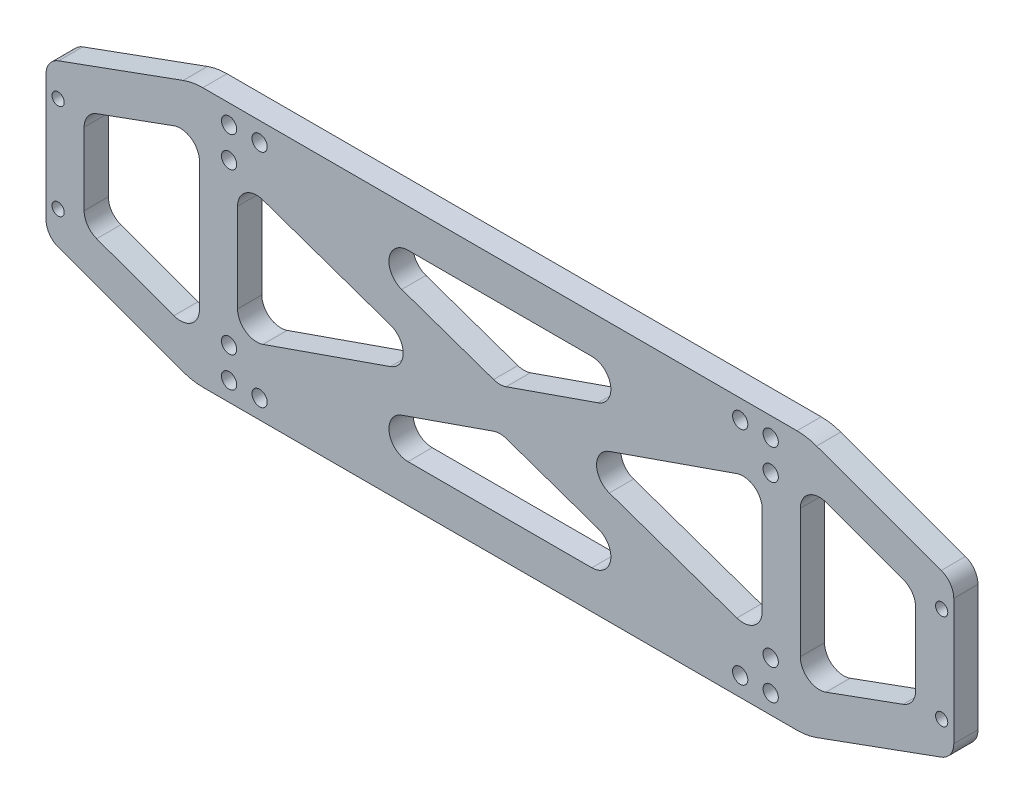
from build123d import *

# Parameters (mm, degrees)
BOSS_EXTRUDE1_DEPTH      = 6.35
M3_CLEARANCE_HOLE1_D     = 3.2
M3_CLEARANCE_HOLE1_DEPTH = 95.7
M3_CLEARANCE_HOLE1_TIP   = 0.96137699
FILLET1_R                = 5
FILLET2_R                = 15
CUT_EXTRUDE1_DEPTH       = 124.924664615
SKETCH6_W                = 10
SKETCH6_H                = 48
BOSS_EXTRUDE2_DEPTH      = 6.35
EXTRUDE_THIN1_DEPTH      = 6.35
F_4_0_REAMED_D           = 4
MIRROR3_COPY_1_D         = 4
FILLET3_R                = 5


with BuildPart() as part:
    # Sketch1 → Boss-Extrude1 (new body)
    with BuildSketch(Plane.XY):
        Polygon((80.535316128, 34), (119, 20), (119, -20), (80.535316128, -34), (-80.535316128, -34), (-119, -20), (-119, 20), (-80.535316128, 34), align=None)
    extrude(amount=BOSS_EXTRUDE1_DEPTH)

    # M3 Clearance Hole1
    with Locations(Plane(origin=(0, 0, 0), x_dir=(1, 0, 0), z_dir=(0, 0, -1))):
        with Locations((115.825, -12.5), (115.825, 12.5), (-115.825, 12.5), (-115.825, -12.5)):
            Hole(M3_CLEARANCE_HOLE1_D / 2, depth=M3_CLEARANCE_HOLE1_DEPTH)
            with Locations((0, 0, -(M3_CLEARANCE_HOLE1_DEPTH + M3_CLEARANCE_HOLE1_TIP / 2))):  # 118° drill point
                Cone(0, M3_CLEARANCE_HOLE1_D / 2, M3_CLEARANCE_HOLE1_TIP, mode=Mode.SUBTRACT)

    # Fillet1
    fillet1_edges = [part.edges().sort_by_distance(p)[0] for p in [
        (119, -20, 3.175),
        (-119, -20, 3.175),
        (-119, 20, 3.175),
        (119, 20, 3.175),
    ]]
    fillet(fillet1_edges, radius=FILLET1_R)

    # Fillet2
    fillet2_edges = [part.edges().sort_by_distance(p)[0] for p in [
        (80.535316128, -34, 3.175),
        (-80.535316128, -34, 3.175),
        (-80.535316128, 34, 3.175),
        (80.535316128, 34, 3.175),
    ]]
    fillet(fillet2_edges, radius=FILLET2_R)

    # Sketch5 → Cut-Extrude1 (cut, through all)
    with BuildSketch(Plane(origin=(0, 0, 0), x_dir=(-1, 0, 0), z_dir=(0, 0, -1))):
        Polygon((-78.772046321, 24), (-109, 12.997924618), (-109, -12.997924618), (-78.772046321, -24), (78.772046321, -24), (109, -12.997924618), (109, 12.997924618), (78.772046321, 24), align=None)
    extrude(amount=-CUT_EXTRUDE1_DEPTH, mode=Mode.SUBTRACT)

    # Sketch6 → Boss-Extrude2 (add)
    with BuildSketch(Plane(origin=(0, 0, 0), x_dir=(-1, 0, 0), z_dir=(0, 0, -1))):
        with Locations((-73.772046321, 0)):
            Rectangle(SKETCH6_W, SKETCH6_H)
        with Locations((73.772046321, 0)):
            Rectangle(SKETCH6_W, SKETCH6_H)
    extrude(amount=-BOSS_EXTRUDE2_DEPTH)

    # Sketch7 → Extrude-Thin1 (add)
    with BuildSketch(Plane(origin=(0, 0, 0), x_dir=(-1, 0, 0), z_dir=(0, 0, -1))):
        Polygon((67.124588801, 28.720792701), (-70.41950384, -19.279207299), (-67.124588801, -28.720792701), (70.41950384, 19.279207299), align=None)
    extrude_thin1 = extrude(amount=-EXTRUDE_THIN1_DEPTH)

    # Mirror1: Extrude-Thin1 across plane
    add(extrude_thin1.mirror(Plane(origin=(0, 0, 0), x_dir=(0, 0, 1), z_dir=(1, 0, 0))))

    # Ø4.0 Reamed (through all)
    with Locations(Plane(origin=(0, 0, 0), x_dir=(-1, 0, 0), z_dir=(0, 0, -1))):
        with Locations((-71, -29), (-63, -29), (-71, -21)):
            f_4_0_reamed = Hole(F_4_0_REAMED_D / 2)

    # Mirror2: Ø4.0 Reamed across plane
    add(f_4_0_reamed.mirror(Plane(origin=(0, 0, 0), x_dir=(0, 0, 1), z_dir=(1, 0, 0))), mode=Mode.SUBTRACT)

    # Mirror3: Ø4.0 Reamed across plane
    add(f_4_0_reamed.mirror(Plane.ZX), mode=Mode.SUBTRACT)

    # Mirror3 copy 1 (through all)
    with Locations(Plane(origin=(0, 0, 0), x_dir=(1, 0, 0), z_dir=(0, 0, -1))):
        with Locations((-71, -29), (-63, -29), (-71, -21)):
            Hole(MIRROR3_COPY_1_D / 2)

    # Fillet3
    fillet3_edges = [part.edges().sort_by_distance(p)[0] for p in [
        (-78.772046321, -24, 3.175),
        (78.772046321, -24, 3.175),
        (109, -12.997924618, 3.175),
        (109, 12.997924618, 3.175),
        (78.772046321, 24, 3.175),
        (-78.772046321, 24, 3.175),
        (-109, 12.997924618, 3.175),
        (-109, -12.997924618, 3.175),
        (-68.772046321, 18.704279221, 3.175),
        (68.772046321, -18.704279221, 3.175),
        (53.597148206, -24, 3.175),
        (-53.597148206, 24, 3.175),
        (0, -5.295720779, 3.175),
        (-15.174898114, 0, 3.175),
        (-68.772046321, -18.704279221, 3.175),
        (53.597148206, 24, 3.175),
        (0, 5.295720779, 3.175),
        (-53.597148206, -24, 3.175),
        (68.772046321, 18.704279221, 3.175),
        (15.174898114, 0, 3.175),
    ]]
    fillet(fillet3_edges, radius=FILLET3_R)


solid = part.part
